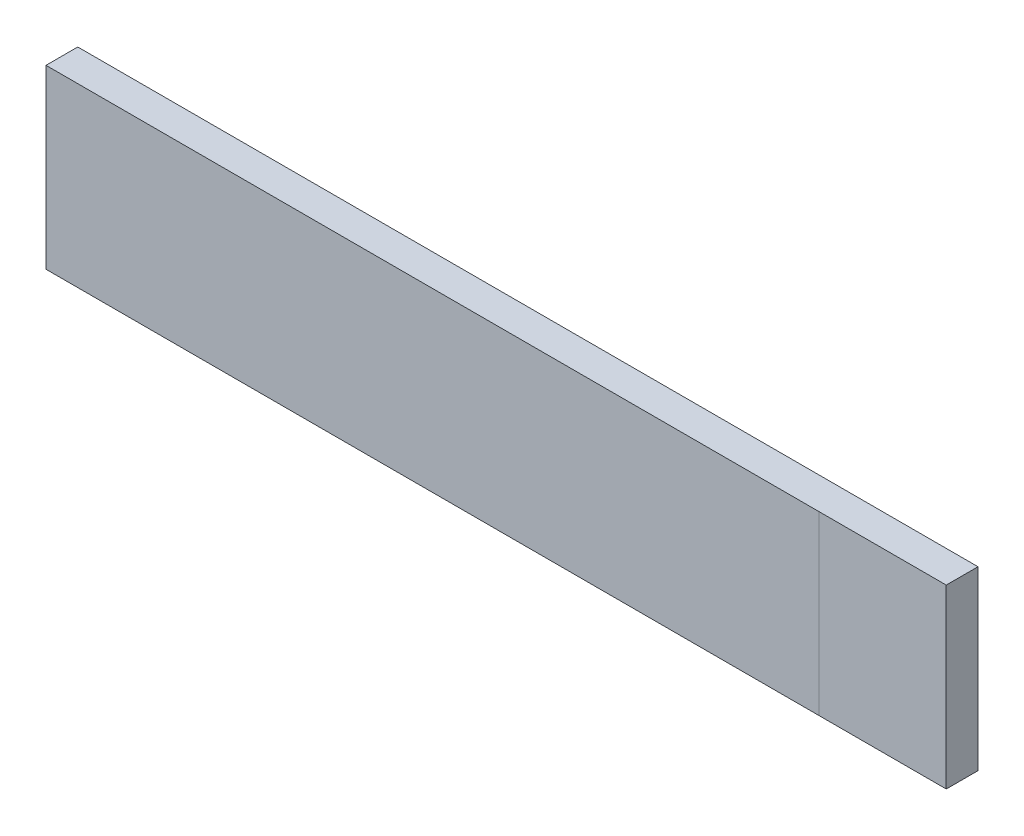
from build123d import *

# Parameters (mm, degrees)
SKETCH_1_W      = 283.466674086
SKETCH_1_H      = 55.6224464
EXTRUDE_1_DEPTH = 10


with BuildPart() as part:
    # 草图1 → 凸台-拉伸1 (new body)
    with BuildSketch(Plane.XY):
        Rectangle(SKETCH_1_W, SKETCH_1_H)
    extrude(amount=EXTRUDE_1_DEPTH)


solid = part.part
